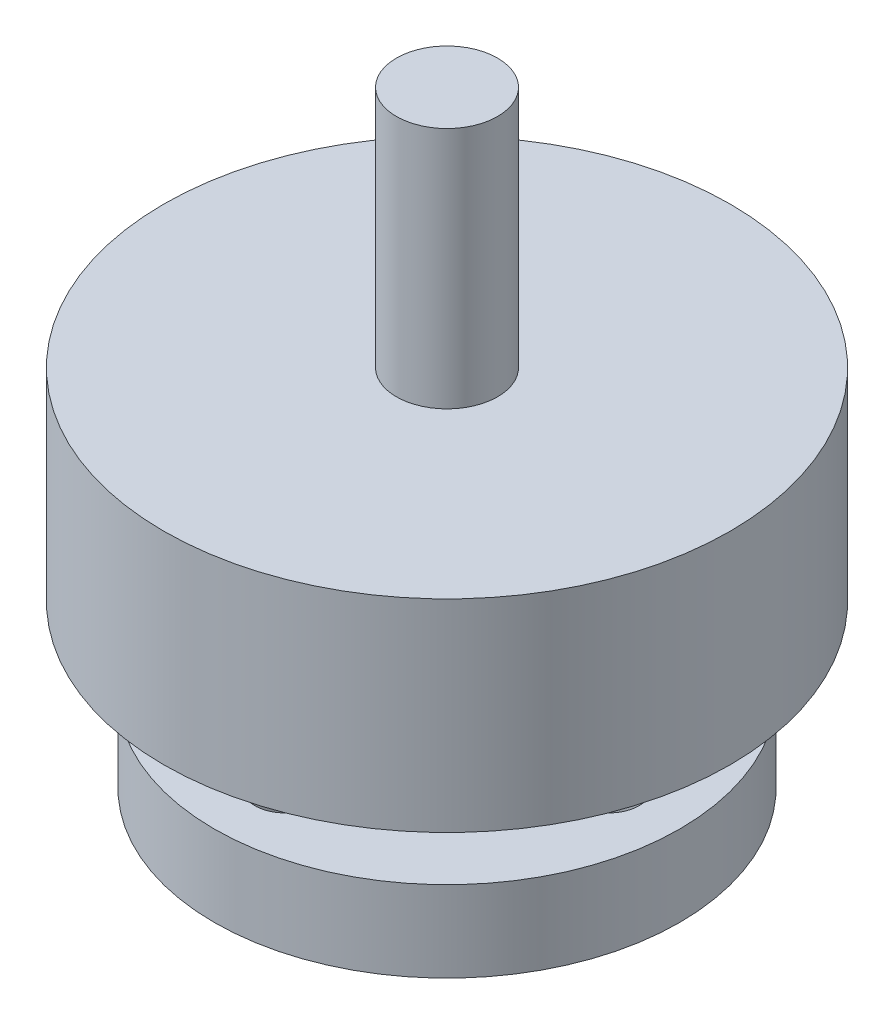
from build123d import *

# Parameters (mm, degrees)
SKETCH2_R          = 1.5
CUT_EXTRUDE1_DEPTH = 4


with BuildPart() as part:
    # Sketch1 → Revolve1 (revolve)
    with BuildSketch(Plane.XY, mode=Mode.PRIVATE) as revolve1_sk:
        Polygon((0, 30), (2.5, 30), (2.5, 18), (14, 18), (14, 8), (5.5, 8), (5.5, 4), (11.5, 4), (11.5, 0), (0, 0), align=None)
    revolve(revolve1_sk.sketch.rotate(Axis((0, 0, 0), (0, 1, 0)), 90), axis=Axis((0, 0, 0), (0, 1, 0)))

    # Sketch2 → Cut-Extrude1 (cut)
    with BuildSketch(Plane.XZ):
        with Locations(Location((0, 8, 0), (0, 0, 270))):
            Circle(SKETCH2_R)
        with Locations(Location((8, 0, 0), (0, 0, 270))):
            Circle(SKETCH2_R)
        with Locations(Location((0, -8, 0), (0, 0, 270))):
            Circle(SKETCH2_R)
        with Locations(Location((-8, 0, 0), (0, 0, 270))):
            Circle(SKETCH2_R)
    extrude(amount=-CUT_EXTRUDE1_DEPTH, mode=Mode.SUBTRACT)


solid = part.part
